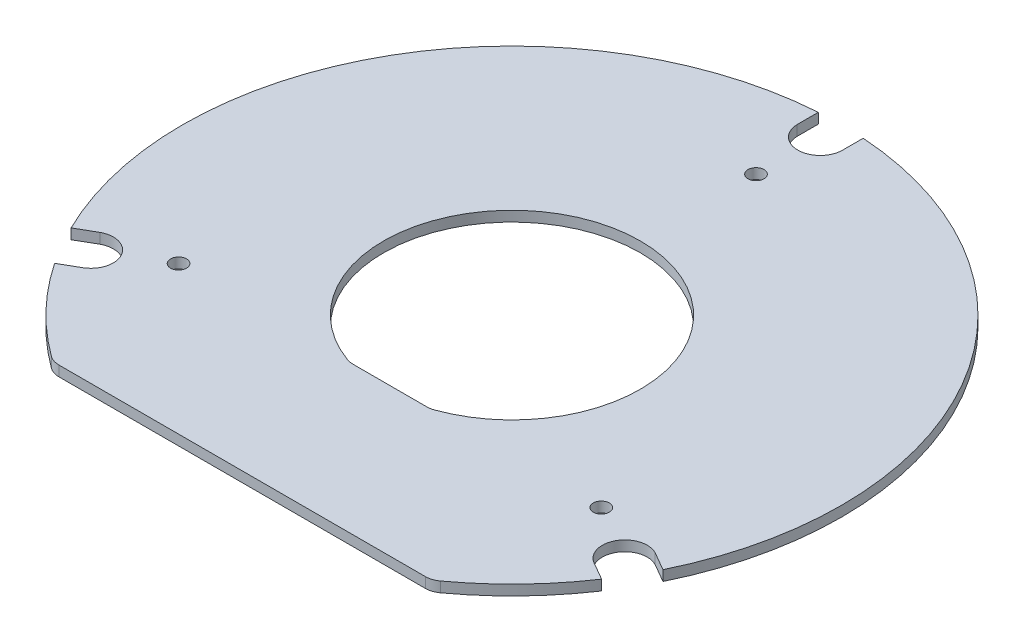
from build123d import *

# Parameters (mm, degrees)
SKETCH_1_R      = 1.25
EXTRUDE_1_DEPTH = 1.6
FILLET_1_R      = 3


with BuildPart() as part:
    # 草图1 → 凸台-拉伸1 (new body)
    with BuildSketch(Plane(origin=(0, 8.4, 0), x_dir=(1, 0, 0), z_dir=(0, 1, 0))):
        with BuildLine():
            ThreePointArc((-42.584930161, -28.625185914), (-36.646174274, -35.915671462), (-29.47672888, -42))
            Line((-29.47672888, -42), (29.47672888, -42))
            ThreePointArc((29.47672888, -42), (36.646174274, -35.915671462), (42.584930161, -28.625185914))
            Line((42.584930161, -28.625185914), (39.709874377, -26.965271683))
            ThreePointArc((39.709874377, -26.965271683), (38.538130468, -22.25), (43.207547486, -20.90712415))
            Line((43.207547486, -20.90712415), (46.08260327, -22.567038381))
            ThreePointArc((46.08260327, -22.567038381), (44.43712591, 25.655786606), (3.497673109, 51.192224295))
            Line((3.497673109, 51.192224295), (3.497673109, 47.872395833))
            ThreePointArc((3.497673109, 47.872395833), (0, 44.5), (-3.497673109, 47.872395833))
            Line((-3.497673109, 47.872395833), (-3.497673109, 51.192224295))
            ThreePointArc((-3.497673109, 51.192224295), (-44.43712591, 25.655786606), (-46.08260327, -22.567038381))
            Line((-46.08260327, -22.567038381), (-43.207547486, -20.90712415))
            ThreePointArc((-43.207547486, -20.90712415), (-38.538130468, -22.25), (-39.709874377, -26.965271683))
            Line((-39.709874377, -26.965271683), (-42.584930161, -28.625185914))
        make_face()
        with Locations(Location((-32.908965344, -19, 0), (0, 0, 270))):
            Circle(SKETCH_1_R, mode=Mode.SUBTRACT)
        with Locations(Location((32.908965344, -19, 0), (0, 0, 270))):
            Circle(SKETCH_1_R, mode=Mode.SUBTRACT)
        with BuildLine():
            Line((6.244997998, -19), (-6.244997998, -19))
            ThreePointArc((-6.244997998, -19), (0, 20), (6.244997998, -19))
        make_face(mode=Mode.SUBTRACT)
        with Locations(Location((0, 38, 0), (0, 0, 270))):
            Circle(SKETCH_1_R, mode=Mode.SUBTRACT)
    extrude(amount=EXTRUDE_1_DEPTH)

    # 圆角1
    fillet_1_edges = [part.edges().sort_by_distance(p)[0] for p in [
        (-29.47672888, 9.2, 42),
        (29.47672888, 9.2, 42),
        (-6.244997998, 9.2, 19),
        (6.244997998, 9.2, 19),
    ]]
    fillet(fillet_1_edges, radius=FILLET_1_R)


solid = part.part
